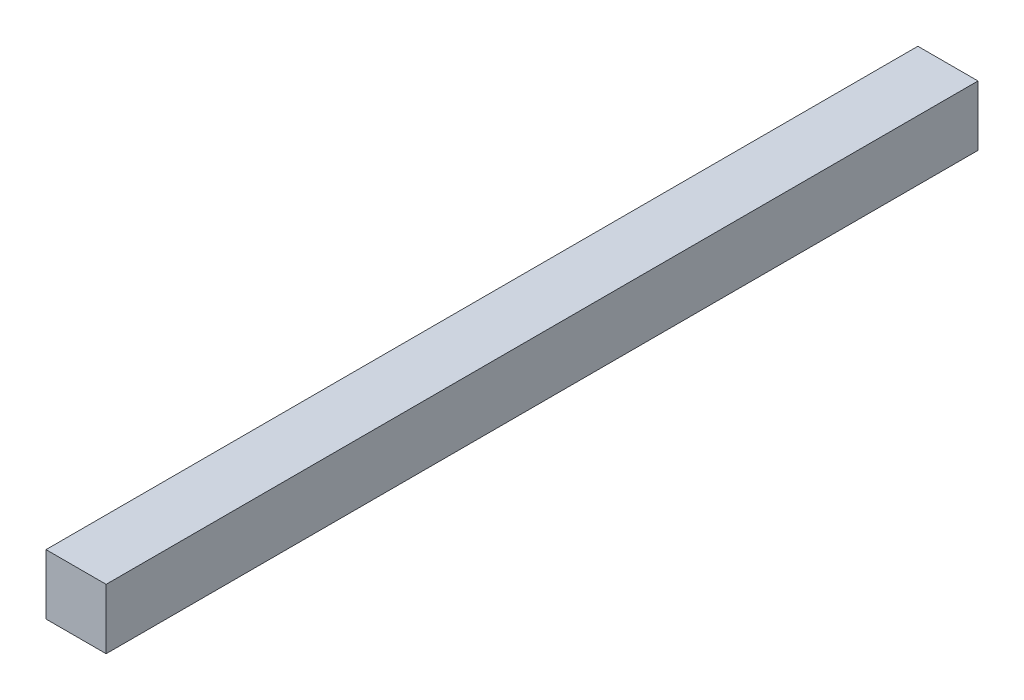
from build123d import *

# Parameters (mm, degrees)
ESBO_O1_W                = 6
ESBO_O1_H                = 87
RESSALTO_EXTRUS_O1_DEPTH = 6


with BuildPart() as part:
    # Esboço1 → Ressalto-extrusão1 (new body)
    with BuildSketch(Plane(origin=(0, 0, 0), x_dir=(1, 0, 0), z_dir=(0, 1, 0))):
        Rectangle(ESBO_O1_W, ESBO_O1_H)
    extrude(amount=RESSALTO_EXTRUS_O1_DEPTH)


solid = part.part
